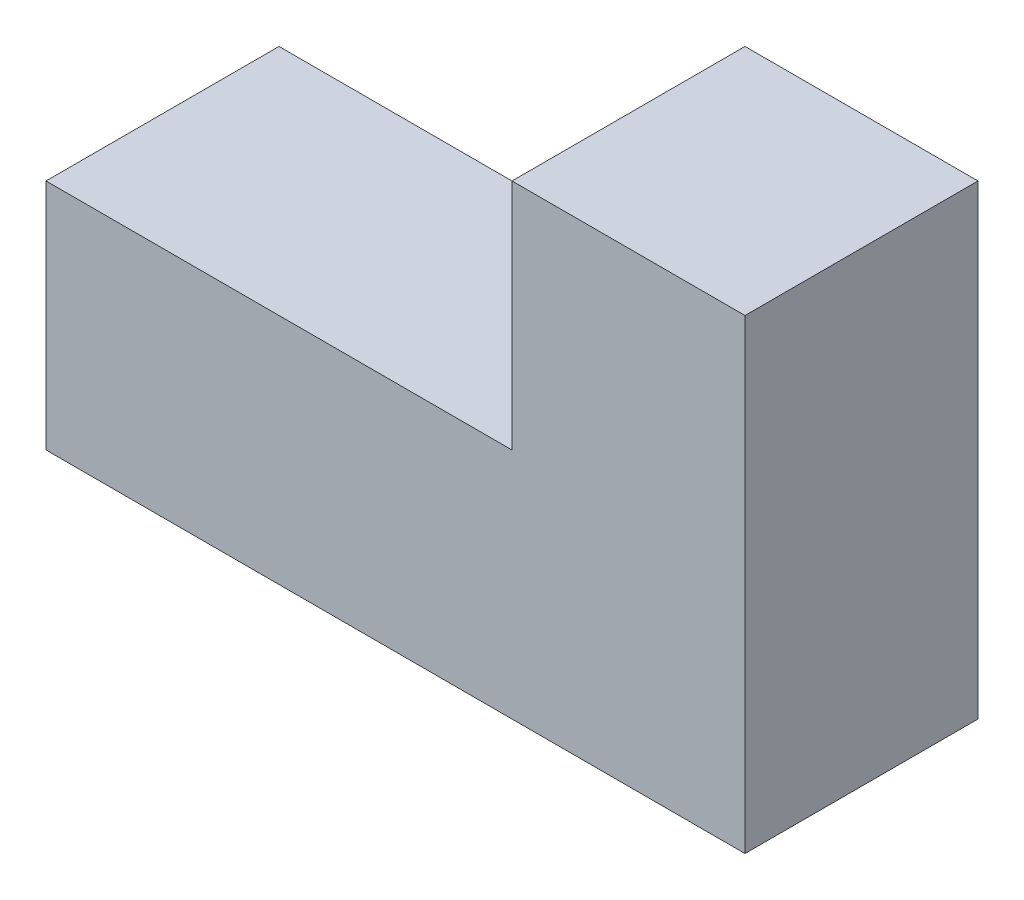
from build123d import *

# Parameters (mm, degrees)
SKETCH_1_W      = 90
SKETCH_1_H      = 30
EXTRUDE_1_DEPTH = 30
SKETCH_2_W      = 30
SKETCH_2_H      = 30
EXTRUDE_2_DEPTH = 30


with BuildPart() as part:
    # 草圖1 → 填料-伸長1 (new body)
    with BuildSketch(Plane.XY):
        with Locations((45, -15)):
            Rectangle(SKETCH_1_W, SKETCH_1_H)
    extrude(amount=EXTRUDE_1_DEPTH)

    # 草圖2 → 填料-伸長2 (add)
    with BuildSketch(Plane(origin=(0, 0, 0), x_dir=(1, 0, 0), z_dir=(0, 1, 0))):
        with Locations((75, -15)):
            Rectangle(SKETCH_2_W, SKETCH_2_H)
    extrude(amount=EXTRUDE_2_DEPTH)


solid = part.part
